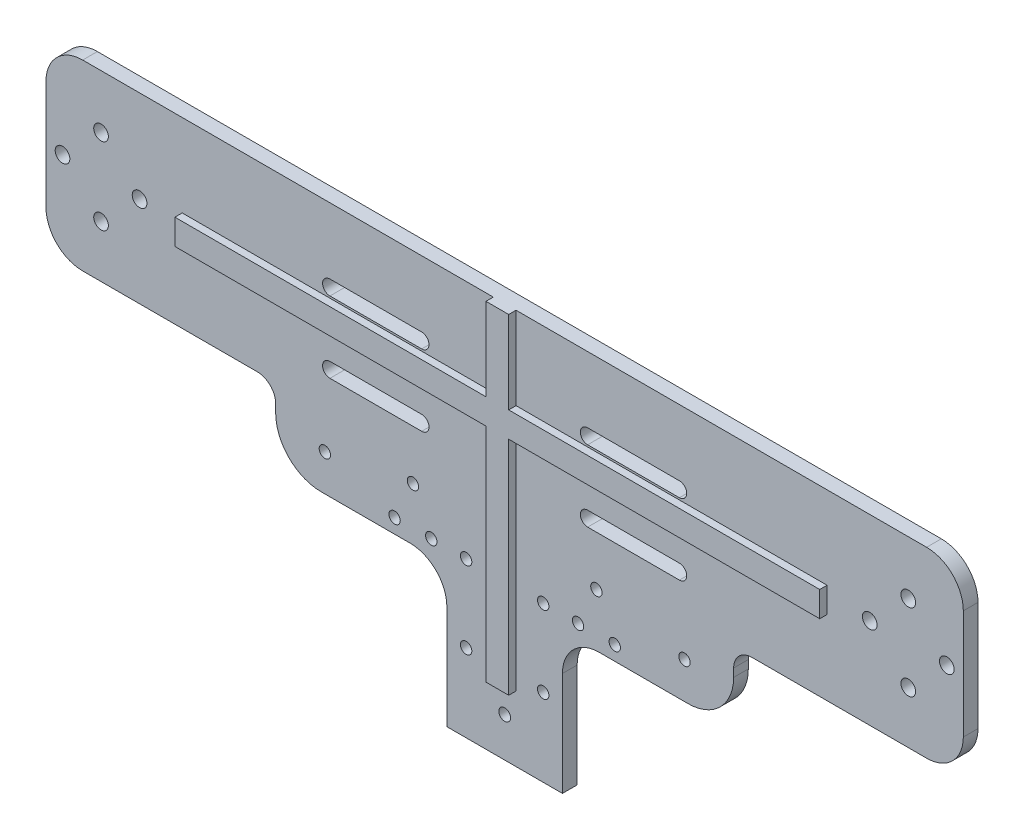
from build123d import *

# Parameters (mm, degrees)
SKETCH_1_R      = 1.55
SKETCH_1_R_2    = 1.6
SKETCH_1_R_3    = 1.546583653
SKETCH_1_R_4    = 2
EXTRUDE_1_DEPTH = 4
EXTRUDE_2_DEPTH = 2


with BuildPart() as part:
    # 草图1 → 凸台-拉伸1 (new body)
    with BuildSketch(Plane.XY):
        with BuildLine():
            Line((-93.257786629, 4.43161967), (-67.403754616, 4.43161967))
            ThreePointArc((-67.403754616, 4.43161967), (-63.86822071, 2.967153575), (-62.403754616, -0.56838033))
            Line((-62.403754616, -0.56838033), (-62.403754616, -2.789641507))
            ThreePointArc((-62.403754616, -2.789641507), (-58.770779001, -11.560420508), (-50, -15.193396123))
            Line((-50, -15.193396123), (-25.75, -15.193396123))
            ThreePointArc((-25.75, -15.193396123), (-18.678932188, -18.122328311), (-15.75, -25.193396123))
            Line((-15.75, -25.193396123), (-15.75, -53.504719017))
            Line((-15.75, -53.504719017), (15.75, -53.504719017))
            Line((15.75, -53.504719017), (15.75, -25.193396123))
            ThreePointArc((15.75, -25.193396123), (18.678932188, -18.122328311), (25.75, -15.193396123))
            Line((25.75, -15.193396123), (50, -15.193396123))
            ThreePointArc((50, -15.193396123), (58.770779001, -11.560420508), (62.403754616, -2.789641507))
            Line((62.403754616, -2.789641507), (62.403754616, -0.56838033))
            ThreePointArc((62.403754616, -0.56838033), (63.86822071, 2.967153575), (67.403754616, 4.43161967))
            Line((67.403754616, 4.43161967), (93.257786629, 4.43161967))
            Line((93.257786629, 4.43161967), (115, 4.43161967))
            ThreePointArc((115, 4.43161967), (122.071067812, 7.360551858), (125, 14.43161967))
            Line((125, 14.43161967), (125, 44.220324858))
            ThreePointArc((125, 44.220324858), (122.071067812, 51.29139267), (115, 54.220324858))
            Line((115, 54.220324858), (95.550812853, 54.220324858))
            Line((95.550812853, 54.220324858), (-95.550812853, 54.220324858))
            Line((-95.550812853, 54.220324858), (-115, 54.220324858))
            ThreePointArc((-115, 54.220324858), (-122.071067812, 51.29139267), (-125, 44.220324858))
            Line((-125, 44.220324858), (-125, 14.43161967))
            ThreePointArc((-125, 14.43161967), (-122.071067812, 7.360551858), (-115, 4.43161967))
            Line((-115, 4.43161967), (-93.257786629, 4.43161967))
        make_face()
        with Locations((-10.5, -32.252284296)):
            Circle(SKETCH_1_R, mode=Mode.SUBTRACT)
        with Locations((-49, -5.252284296)):
            Circle(SKETCH_1_R, mode=Mode.SUBTRACT)
        with Locations((-30, -11.252284296)):
            Circle(SKETCH_1_R, mode=Mode.SUBTRACT)
        with Locations((-20, -11.252284296)):
            Circle(SKETCH_1_R, mode=Mode.SUBTRACT)
        with Locations((-10.5, -11.252284296)):
            Circle(SKETCH_1_R, mode=Mode.SUBTRACT)
        with Locations((-25, -0.752284296)):
            Circle(SKETCH_1_R, mode=Mode.SUBTRACT)
        with Locations((0, -0.752284296)):
            Circle(SKETCH_1_R, mode=Mode.SUBTRACT)
        with Locations((0, -42.752284296)):
            Circle(SKETCH_1_R_2, mode=Mode.SUBTRACT)
        with Locations((10.5, -32.252284296)):
            Circle(SKETCH_1_R, mode=Mode.SUBTRACT)
        with Locations((0, -21.748867949)):
            Circle(SKETCH_1_R_3, mode=Mode.SUBTRACT)
        with Locations((10.5, -11.252284296)):
            Circle(SKETCH_1_R, mode=Mode.SUBTRACT)
        with Locations((20, -11.252284296)):
            Circle(SKETCH_1_R, mode=Mode.SUBTRACT)
        with Locations((30, -11.252284296)):
            Circle(SKETCH_1_R, mode=Mode.SUBTRACT)
        with Locations((25, -0.752284296)):
            Circle(SKETCH_1_R, mode=Mode.SUBTRACT)
        with Locations((49, -5.252284296)):
            Circle(SKETCH_1_R, mode=Mode.SUBTRACT)
        with Locations((-110, 18.626388225)):
            Circle(SKETCH_1_R_4, mode=Mode.SUBTRACT)
        with BuildLine():
            ThreePointArc((-47.619318323, 12.788573549), (-49.619318323, 14.788573549), (-47.619318323, 16.788573549))
            Line((-47.619318323, 16.788573549), (-22.619318323, 16.788573549))
            ThreePointArc((-22.619318323, 16.788573549), (-20.619318323, 14.788573549), (-22.619318323, 12.788573549))
            Line((-22.619318323, 12.788573549), (-47.619318323, 12.788573549))
        make_face(mode=Mode.SUBTRACT)
        with Locations((-120.5, 29.126388225)):
            Circle(SKETCH_1_R_4, mode=Mode.SUBTRACT)
        with Locations((-99.5, 29.126388225)):
            Circle(SKETCH_1_R_4, mode=Mode.SUBTRACT)
        with Locations((-110, 39.626388225)):
            Circle(SKETCH_1_R_4, mode=Mode.SUBTRACT)
        with BuildLine():
            ThreePointArc((-47.619318323, 32.223901574), (-49.619318323, 34.223901574), (-47.619318323, 36.223901574))
            Line((-47.619318323, 36.223901574), (-22.619318323, 36.223901574))
            ThreePointArc((-22.619318323, 36.223901574), (-20.619318323, 34.223901574), (-22.619318323, 32.223901574))
            Line((-22.619318323, 32.223901574), (-47.619318323, 32.223901574))
        make_face(mode=Mode.SUBTRACT)
        with BuildLine():
            Line((22.619318323, 16.788573549), (47.619318323, 16.788573549))
            ThreePointArc((47.619318323, 16.788573549), (49.619318323, 14.788573549), (47.619318323, 12.788573549))
            Line((47.619318323, 12.788573549), (22.619318323, 12.788573549))
            ThreePointArc((22.619318323, 12.788573549), (20.619318323, 14.788573549), (22.619318323, 16.788573549))
        make_face(mode=Mode.SUBTRACT)
        with Locations((110, 18.626388225)):
            Circle(SKETCH_1_R_4, mode=Mode.SUBTRACT)
        with BuildLine():
            Line((22.619318323, 36.223901574), (47.619318323, 36.223901574))
            ThreePointArc((47.619318323, 36.223901574), (49.619318323, 34.223901574), (47.619318323, 32.223901574))
            Line((47.619318323, 32.223901574), (22.619318323, 32.223901574))
            ThreePointArc((22.619318323, 32.223901574), (20.619318323, 34.223901574), (22.619318323, 36.223901574))
        make_face(mode=Mode.SUBTRACT)
        with Locations((99.5, 29.126388225)):
            Circle(SKETCH_1_R_4, mode=Mode.SUBTRACT)
        with Locations((120.5, 29.126388225)):
            Circle(SKETCH_1_R_4, mode=Mode.SUBTRACT)
        with Locations((110, 39.626388225)):
            Circle(SKETCH_1_R_4, mode=Mode.SUBTRACT)
    extrude(amount=EXTRUDE_1_DEPTH)

    # 草图2 → 凸台-拉伸2 (add)
    with BuildSketch(Plane.XY.offset(4)):
        Polygon((3.098482938, -35.658654768), (-3.098482938, -35.658654768), (-3.098482938, 24.781778974), (-87.869942148, 24.781778974), (-87.869942148, 31.693824975), (-3.098482938, 31.693824975), (-3.098482938, 54.220324858), (3.098482938, 54.220324858), (3.098482938, 31.693824975), (87.869942148, 31.693824975), (87.869942148, 24.781778974), (3.098482938, 24.781778974), align=None)
    extrude(amount=EXTRUDE_2_DEPTH)


solid = part.part
